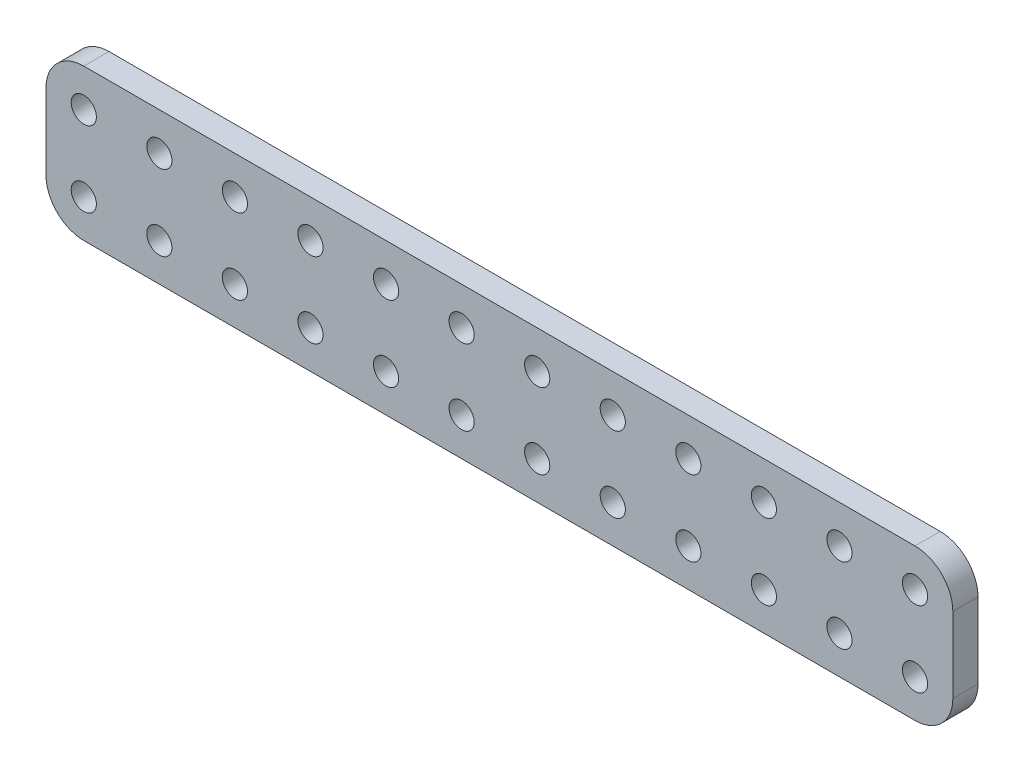
from build123d import *

# Parameters (mm, degrees)
MODEL_R                 = 1.5
SALIENTE_EXTRUIR1_DEPTH = 3


with BuildPart() as part:
    # Model → Saliente-Extruir1 (new body)
    with BuildSketch(Plane.XY):
        with BuildLine():
            Line((256.429131311, 228.742243614), (355.429131311, 228.742243614))
            ThreePointArc((355.429131311, 228.742243614), (358.611111826, 227.424224129), (359.929131311, 224.242243614))
            Line((359.929131311, 224.242243614), (359.929131311, 215.242243614))
            ThreePointArc((359.929131311, 215.242243614), (358.611111826, 212.060263099), (355.429131311, 210.742243614))
            Line((355.429131311, 210.742243614), (256.429131311, 210.742243614))
            ThreePointArc((256.429131311, 210.742243614), (253.247150795, 212.060263099), (251.929131311, 215.242243614))
            Line((251.929131311, 215.242243614), (251.929131311, 224.242243614))
            ThreePointArc((251.929131311, 224.242243614), (253.247150795, 227.424224129), (256.429131311, 228.742243614))
        make_face()
        with Locations((310.429131311, 224.242243614)):
            Circle(MODEL_R, mode=Mode.SUBTRACT)
        with Locations((292.429131311, 224.242243614)):
            Circle(MODEL_R, mode=Mode.SUBTRACT)
        with Locations((301.429131311, 224.242243614)):
            Circle(MODEL_R, mode=Mode.SUBTRACT)
        with Locations((337.429131311, 215.242243614)):
            Circle(MODEL_R, mode=Mode.SUBTRACT)
        with Locations((319.429131311, 215.242243614)):
            Circle(MODEL_R, mode=Mode.SUBTRACT)
        with Locations((328.429131311, 215.242243614)):
            Circle(MODEL_R, mode=Mode.SUBTRACT)
        with Locations((310.429131311, 215.242243614)):
            Circle(MODEL_R, mode=Mode.SUBTRACT)
        with Locations((292.429131311, 215.242243614)):
            Circle(MODEL_R, mode=Mode.SUBTRACT)
        with Locations((301.429131311, 215.242243614)):
            Circle(MODEL_R, mode=Mode.SUBTRACT)
        with Locations((274.429131311, 215.242243614)):
            Circle(MODEL_R, mode=Mode.SUBTRACT)
        with Locations((283.429131311, 215.242243614)):
            Circle(MODEL_R, mode=Mode.SUBTRACT)
        with Locations((265.429131311, 215.242243614)):
            Circle(MODEL_R, mode=Mode.SUBTRACT)
        with Locations((256.429131311, 215.242243614)):
            Circle(MODEL_R, mode=Mode.SUBTRACT)
        with Locations((346.429131311, 215.242243614)):
            Circle(MODEL_R, mode=Mode.SUBTRACT)
        with Locations((274.429131311, 224.242243614)):
            Circle(MODEL_R, mode=Mode.SUBTRACT)
        with Locations((265.429131311, 224.242243614)):
            Circle(MODEL_R, mode=Mode.SUBTRACT)
        with Locations((256.429131311, 224.242243614)):
            Circle(MODEL_R, mode=Mode.SUBTRACT)
        with Locations((283.429131311, 224.242243614)):
            Circle(MODEL_R, mode=Mode.SUBTRACT)
        with Locations((337.429131311, 224.242243614)):
            Circle(MODEL_R, mode=Mode.SUBTRACT)
        with Locations((319.429131311, 224.242243614)):
            Circle(MODEL_R, mode=Mode.SUBTRACT)
        with Locations((328.429131311, 224.242243614)):
            Circle(MODEL_R, mode=Mode.SUBTRACT)
        with Locations((346.429131311, 224.242243614)):
            Circle(MODEL_R, mode=Mode.SUBTRACT)
        with Locations((355.429131311, 215.242243614)):
            Circle(MODEL_R, mode=Mode.SUBTRACT)
        with Locations((355.429131311, 224.242243614)):
            Circle(MODEL_R, mode=Mode.SUBTRACT)
    extrude(amount=SALIENTE_EXTRUIR1_DEPTH)


solid = part.part
